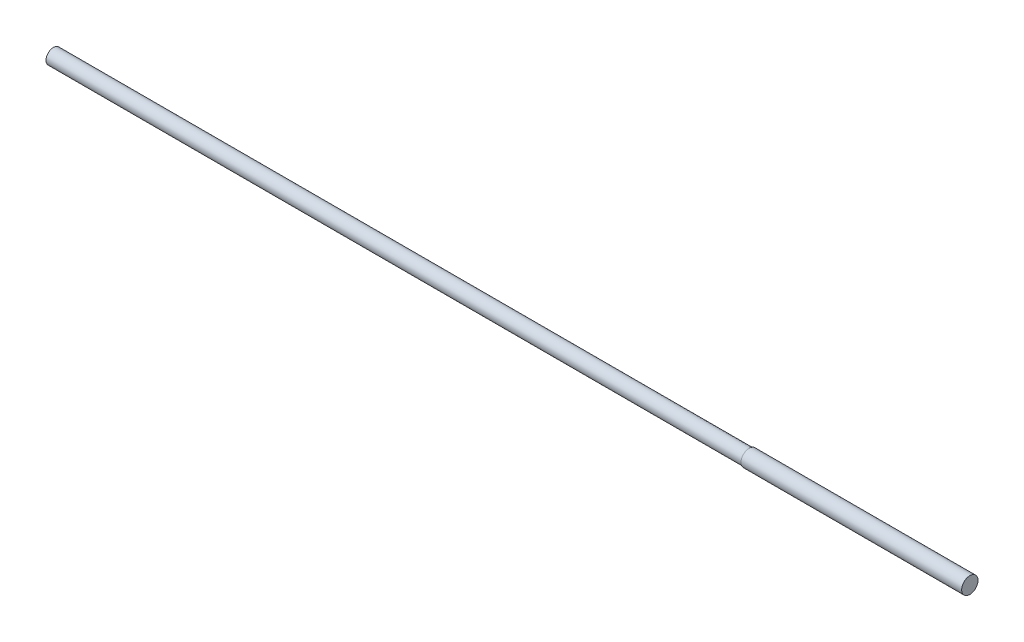
from build123d import *

# Parameters (mm, degrees)
SCHIZZO1_R                   = 0.845
ESTRUSIONE_ESTRUSIONE1_DEPTH = 103.82
SCHIZZO2_R                   = 0.925
ESTRUSIONE_ESTRUSIONE2_DEPTH = 25


with BuildPart() as part:
    # Schizzo1 → Estrusione-Estrusione1 (new body)
    with BuildSketch(Plane(origin=(0, 0, 0), x_dir=(0, 0, -1), z_dir=(1, 0, 0))):
        Circle(SCHIZZO1_R)
    extrude(amount=ESTRUSIONE_ESTRUSIONE1_DEPTH)

    # Schizzo2 → Estrusione-Estrusione2 (add)
    with BuildSketch(Plane(origin=(103.82, 0, 0), x_dir=(0, 0, -1), z_dir=(1, 0, 0))):
        Circle(SCHIZZO2_R)
    extrude(amount=-ESTRUSIONE_ESTRUSIONE2_DEPTH)


solid = part.part
